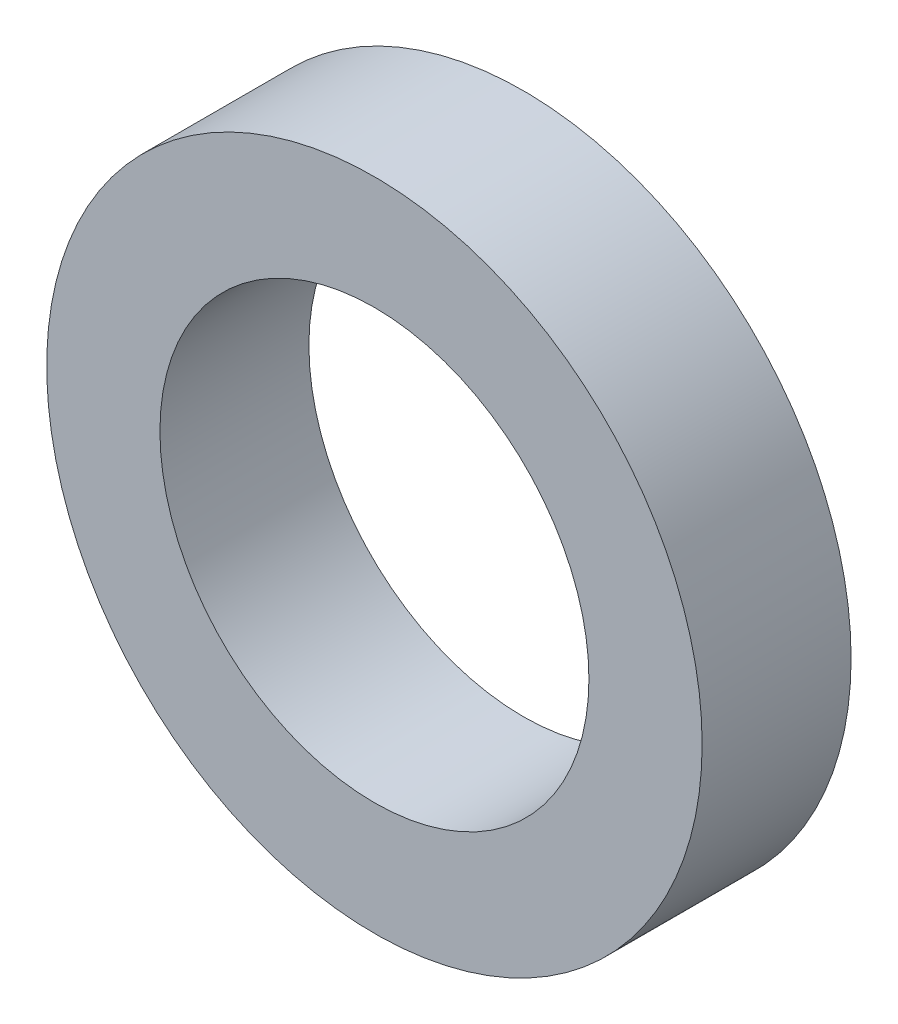
from build123d import *

# Parameters (mm, degrees)
F_0172_CYLINDER_SKETCH_R = 5.5
F_0172_CYLINDER_DEPTH    = 2.5
F_0173_CYLINDER_SKETCH_R = 3.6
F_0173_CYLINDER_DEPTH    = 5


with BuildPart() as part:
    # 0172_cylinder_Sketch → 0172_cylinder (new body)
    with BuildSketch(Plane.XY):
        Circle(F_0172_CYLINDER_SKETCH_R)
    extrude(amount=F_0172_CYLINDER_DEPTH)


with BuildPart() as body_2:
    # 0173_cylinder_Sketch → 0173_cylinder (new body)
    with BuildSketch(Plane.XY):
        Circle(F_0173_CYLINDER_SKETCH_R)
    extrude(amount=F_0173_CYLINDER_DEPTH)


with BuildPart() as body_2_1:
    # 0173_cylinder_Translate: moved
    add(body_2.part.moved(Location((0, 0, -2.5))))


with BuildPart() as part_1:
    add(part.part)

    # 0174_sub: cut body 2
    add(body_2_1.part, mode=Mode.SUBTRACT)


solid = part_1.part
